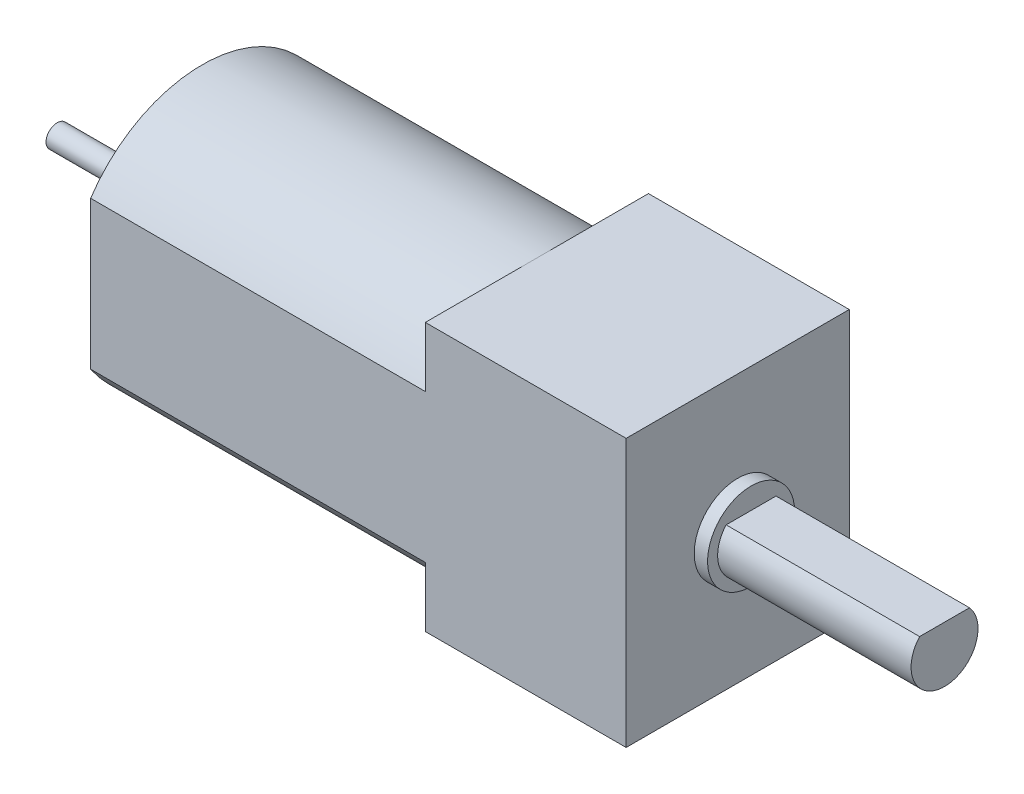
from build123d import *

# Parameters (mm, degrees)
BOSS_EXTRU_1_DEPTH      = 15
ESQUISSE2_R             = 2.5
BOSS_EXTRU_2_DEPTH      = 2
ESQUISSE3_W             = 10
ESQUISSE3_H             = 12
BOSS_EXTRU_3_DEPTH      = 9
ESQUISSE4_R             = 1.95
BOSS_EXTRU_4_DEPTH      = 0.6
ESQUISSE5_R             = 1.5
BOSS_EXTRU_5_DEPTH      = 8.67
ENL_V_START             = -8.67
ENL_V_MAT_EXTRU_1_DEPTH = 8.67
ESQUISSE7_R             = 0.5
BOSS_EXTRU_6_DEPTH      = 4.5


with BuildPart() as part:
    # Esquisse1 → Boss.-Extru.1 (new body)
    with BuildSketch(Plane(origin=(0, 0, 0), x_dir=(0, 0, -1), z_dir=(1, 0, 0))):
        with BuildLine():
            Line((-5, 3.31662479), (-5, -3.31662479))
            ThreePointArc((-5, -3.31662479), (0, -6), (5, -3.31662479))
            Line((5, -3.31662479), (5, 3.31662479))
            ThreePointArc((5, 3.31662479), (0, 6), (-5, 3.31662479))
        make_face()
    extrude(amount=BOSS_EXTRU_1_DEPTH)

    # Esquisse2 → Boss.-Extru.2 (add)
    with BuildSketch(Plane.ZY):
        Circle(ESQUISSE2_R)
    extrude(amount=BOSS_EXTRU_2_DEPTH)

    # Esquisse3 → Boss.-Extru.3 (add)
    with BuildSketch(Plane(origin=(15, 0, 0), x_dir=(0, 0, -1), z_dir=(1, 0, 0))):
        Rectangle(ESQUISSE3_W, ESQUISSE3_H)
    extrude(amount=BOSS_EXTRU_3_DEPTH)

    # Esquisse4 → Boss.-Extru.4 (add)
    with BuildSketch(Plane(origin=(24, 0, 0), x_dir=(0, 0, -1), z_dir=(1, 0, 0))):
        Circle(ESQUISSE4_R)
    extrude(amount=BOSS_EXTRU_4_DEPTH)

    # Esquisse5 → Boss.-Extru.5 (add)
    with BuildSketch(Plane(origin=(24.6, 0, 0), x_dir=(0, 0, -1), z_dir=(1, 0, 0))):
        Circle(ESQUISSE5_R)
    extrude(amount=BOSS_EXTRU_5_DEPTH)

    # Esquisse6 → Enlèv. mat.-Extru.1 (cut)
    with BuildSketch(Plane(origin=(33.27, 0, 0), x_dir=(0, 0, -1), z_dir=(1, 0, 0)).offset(ENL_V_START)):
        with BuildLine():
            Line((-1.118033989, 1), (1.118033989, 1))
            ThreePointArc((1.118033989, 1), (0, 1.5), (-1.118033989, 1))
        make_face()
    extrude(amount=ENL_V_MAT_EXTRU_1_DEPTH, mode=Mode.SUBTRACT)

    # Esquisse7 → Boss.-Extru.6 (add)
    with BuildSketch(Plane.ZY.offset(2)):
        Circle(ESQUISSE7_R)
    extrude(amount=BOSS_EXTRU_6_DEPTH)


solid = part.part
